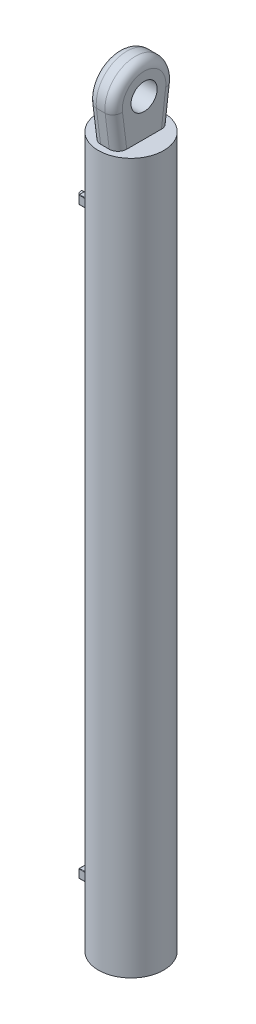
from build123d import *

# Parameters (mm, degrees)
SKETCH_1_R          = 75
SKETCH_1_R_2        = 45
EXTRUDE_1_DEPTH     = 1620
SKETCH_2_R          = 75
EXTRUDE_2_DEPTH     = 10
SKETCH_3_W          = 60
SKETCH_3_H          = 150
EXTRUDE_3_DEPTH     = 200
SKETCH_4_R          = 30
CUT_EXTRUDE_1_DEPTH = 1835.543539958
FILLET_1_R          = 20
EXTRUDE_4_DEPTH     = 20
SKETCH_6_R          = 10
EXTRUDE_5_DEPTH     = 660
SKETCH_10_R         = 5
SKETCH_10_R_2       = 2.5
EXTRUDE_6_DEPTH     = 10
FILLET_2_R          = 1


with BuildPart() as part:
    # 草图1 → 凸台-拉伸1 (new body)
    with BuildSketch(Plane(origin=(0, 0, 0), x_dir=(1, 0, 0), z_dir=(0, 1, 0))):
        with Locations(Location((0, 0, 0), (0, 0, 270))):
            Circle(SKETCH_1_R)
        with Locations(Location((0, 0, 0), (0, 0, 270))):
            Circle(SKETCH_1_R_2, mode=Mode.SUBTRACT)
    extrude(amount=EXTRUDE_1_DEPTH)

    # 草图2 → 凸台-拉伸2 (add)
    with BuildSketch(Plane(origin=(0, 1620, 0), x_dir=(1, 0, 0), z_dir=(0, 1, 0))):
        with Locations(Location((0, 0, 0), (0, 0, 270))):
            Circle(SKETCH_2_R)
    extrude(amount=EXTRUDE_2_DEPTH)

    # 草图3 → 凸台-拉伸3 (add)
    with BuildSketch(Plane(origin=(0, 1630, 0), x_dir=(1, 0, 0), z_dir=(0, 1, 0))):
        Rectangle(SKETCH_3_W, SKETCH_3_H)
    extrude(amount=EXTRUDE_3_DEPTH)

    # 草图4 → 切除-拉伸1 (cut, through all)
    with BuildSketch(Plane(origin=(30, 0, 0), x_dir=(0, 0, -1), z_dir=(1, 0, 0))):
        with Locations((0, 1715)):
            Circle(SKETCH_4_R)
        with BuildLine():
            Line((75, 1830), (75, 1630))
            Line((75, 1630), (60, 1630))
            Line((60, 1630), (69.468399859, 1706.389458724))
            ThreePointArc((69.468399859, 1706.389458724), (0, 1785), (-69.468399859, 1706.389458724))
            Line((-69.468399859, 1706.389458724), (-60, 1630))
            Line((-60, 1630), (-75, 1630))
            Line((-75, 1630), (-75, 1830))
            Line((-75, 1830), (75, 1830))
        make_face()
    extrude(amount=-CUT_EXTRUDE_1_DEPTH, mode=Mode.SUBTRACT)

    # 圆角1
    fillet_1_edges = [part.edges().sort_by_distance(p)[0] for p in [
        (-30, 1785, 0),
        (-30, 1668.194729362, 64.734199929),
        (-30, 1668.194729362, -64.734199929),
        (30, 1785, 0),
        (30, 1668.194729362, -64.734199929),
        (30, 1668.194729362, 64.734199929),
    ]]
    fillet(fillet_1_edges, radius=FILLET_1_R)

    # 草图5 → 凸台-拉伸4 (add)
    with BuildSketch(Plane(origin=(0, 100, 0), x_dir=(-1, 0, 0), z_dir=(0, -1, 0))):
        with BuildLine():
            Line((73.484692283, 15), (105, 15))
            Line((105, 15), (105, -15))
            Line((105, -15), (73.484692283, -15))
            ThreePointArc((73.484692283, -15), (75, 0), (73.484692283, 15))
        make_face()
    extrude_4 = extrude(amount=-EXTRUDE_4_DEPTH)

    # 草图6 → 凸台-拉伸5 (add)
    with BuildSketch(Plane(origin=(0, 120, 0), x_dir=(-1, 0, 0), z_dir=(0, -1, 0))):
        with Locations(Location((89.242346142, 0, 0), (0, 0, 90))):
            Circle(SKETCH_6_R)
    extrude_5 = extrude(amount=-EXTRUDE_5_DEPTH)

    # 镜向2: 凸台-拉伸4, 凸台-拉伸5 across plane
    add(extrude_4.mirror(Plane(origin=(-89.242346142, 780, 0), x_dir=(0, 0, 1), z_dir=(0, -1, 0))))
    add(extrude_5.mirror(Plane(origin=(-89.242346142, 780, 0), x_dir=(0, 0, 1), z_dir=(0, -1, 0))))

    # 草图10 → 凸台-拉伸6 (add)
    with BuildSketch(Plane.ZY.offset(105)):
        with Locations(Location((0, 1450, 0), (0, 0, 180))):
            Circle(SKETCH_10_R)
        with Locations((0, 1450)):
            Circle(SKETCH_10_R_2, mode=Mode.SUBTRACT)
    extrude(amount=EXTRUDE_6_DEPTH)

    # 圆角2
    fillet_2_edges = [part.edges().sort_by_distance(p)[0] for p in [
        (-89.242346142, 1440, 15),
        (-105, 1450, 15),
        (-89.242346142, 1460, 15),
        (-105, 1440, 0),
        (-89.242346142, 1440, -15),
        (-105, 1450, -15),
        (-105, 1460, 0),
        (-89.242346142, 1460, -15),
        (-89.242346142, 100, 15),
        (-89.242346142, 120, 15),
        (-105, 100, 0),
        (-89.242346142, 100, -15),
        (-89.242346142, 120, -15),
        (-105, 120, 0),
        (-105, 110, -15),
    ]]
    fillet(fillet_2_edges, radius=FILLET_2_R)


solid = part.part
